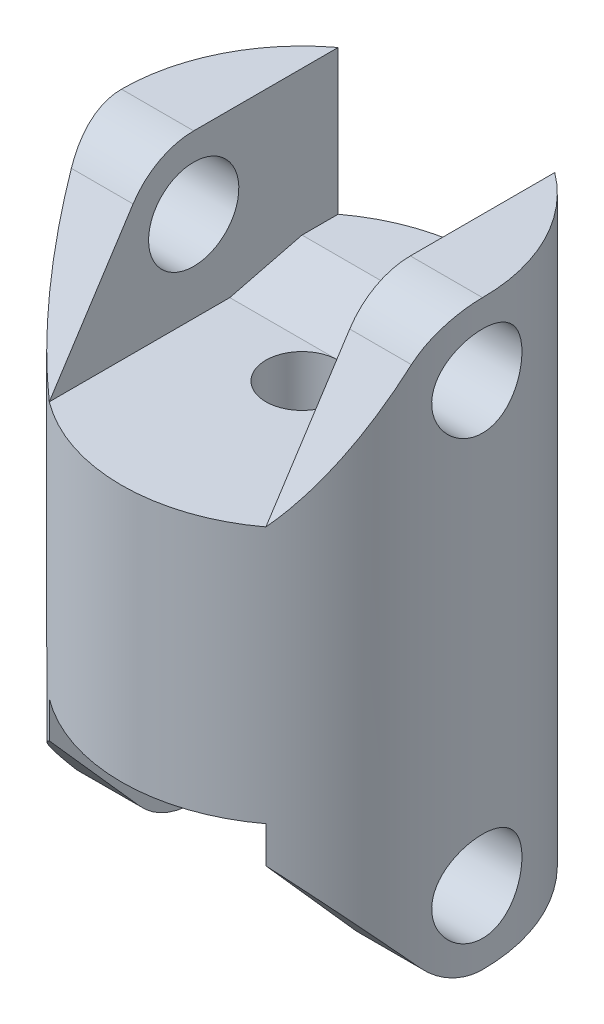
from build123d import *

# Parameters (mm, degrees)
SKETCH1_R               = 12.7
BOSS_EXTRUDE1_DEPTH     = 40.9448
CUT_EXTRUDE1_START      = -11.43
CUT_EXTRUDE1_DEPTH      = 11.43
CUT_EXTRUDE2_DEPTH      = 11.43
CUT_EXTRUDE3_DEPTH      = 48.441216753
CUT_EXTRUDE3_DEPTH_BACK = 48.441216753
SKETCH4_R               = 3.175
SKETCH5_R               = 2.54
CUT_EXTRUDE4_DEPTH      = 35.550013459
BOSS_EXTRUDE2_REACH     = 49.441
BOSS_EXTRUDE3_DEPTH     = 1.27


with BuildPart() as part:
    # Sketch1 → Boss-Extrude1 (new body)
    with BuildSketch(Plane(origin=(0, 0, 0), x_dir=(1, 0, 0), z_dir=(0, 1, 0))):
        with Locations(Location((0, 0, 0), (0, 0, 270))):
            Circle(SKETCH1_R)
    extrude(amount=BOSS_EXTRUDE1_DEPTH)

    # Sketch2 → Cut-Extrude1 (cut)
    with BuildSketch(Plane(origin=(0, 40.9448, 0), x_dir=(1, 0, 0), z_dir=(0, 1, 0)).offset(CUT_EXTRUDE1_START)):
        with BuildLine():
            Line((7.62, 10.16), (7.62, -10.16))
            ThreePointArc((7.62, -10.16), (0, -12.7), (-7.62, -10.16))
            Line((-7.62, -10.16), (-7.62, 10.16))
            ThreePointArc((-7.62, 10.16), (0, 12.7), (7.62, 10.16))
        make_face()
    extrude(amount=CUT_EXTRUDE1_DEPTH, mode=Mode.SUBTRACT)

    # Sketch3 → Cut-Extrude2 (cut)
    with BuildSketch(Plane.XZ):
        with BuildLine():
            Line((-7.62, 10.16), (-7.62, -10.16))
            ThreePointArc((-7.62, -10.16), (0, -12.7), (7.62, -10.16))
            Line((7.62, -10.16), (7.62, 10.16))
            ThreePointArc((7.62, 10.16), (0, 12.7), (-7.62, 10.16))
        make_face()
    extrude(amount=-CUT_EXTRUDE2_DEPTH, mode=Mode.SUBTRACT)

    # Sketch4 → Cut-Extrude3 (cut, two sides: drawn at the far end of the back side and taken through both)
    with BuildSketch(Plane(origin=(-7.62, 0, 0), x_dir=(0, 0, -1), z_dir=(1, 0, 0)).offset(-CUT_EXTRUDE3_DEPTH_BACK)):
        with Locations(Location((0, 35.8648, 0), (0, 0, 270))):
            Circle(SKETCH4_R)
        with Locations(Location((0, 5.08, 0), (0, 0, 270))):
            Circle(SKETCH4_R)
        with BuildLine():
            Line((0, 40.9448), (-10.16, 40.9448))
            Line((-10.16, 40.9448), (-10.16, 29.5148))
            Line((-10.16, 29.5148), (-4.264917923, 38.624668677))
            ThreePointArc((-4.264917923, 38.624668677), (-2.427577715, 40.327228312), (0, 40.9448))
        make_face()
        with BuildLine():
            Line((0, 0), (-12.443407893, 0))
            Line((-12.443407893, 0), (-12.443407893, 11.43))
            Line((-12.443407893, 11.43), (-3.796422114, 1.704562379))
            ThreePointArc((-3.796422114, 1.704562379), (-2.080766311, 0.445691901), (0, 0))
        make_face()
    extrude(amount=CUT_EXTRUDE3_DEPTH + CUT_EXTRUDE3_DEPTH_BACK, mode=Mode.SUBTRACT)

    # Sketch5 → Cut-Extrude4 (cut, through all)
    with BuildSketch(Plane(origin=(0, 29.5148, 0), x_dir=(1, 0, 0), z_dir=(0, 1, 0))):
        with Locations(Location((0, 0, 0), (0, 0, 270))):
            Circle(SKETCH5_R)
    extrude(amount=-CUT_EXTRUDE4_DEPTH, mode=Mode.SUBTRACT)

    # Boss-Extrude2: up to this face of the body (flat: up to its plane)
    boss_extrude2_end = Plane(part.part.faces().sort_by_distance((7.62, 29.747941009, 0))[0])
    # Sketch6 → Boss-Extrude2 (add, up to the picked face)
    with BuildSketch(Plane(origin=(-7.62, 0, 0), x_dir=(0, 0, -1), z_dir=(1, 0, 0)), mode=Mode.PRIVATE) as boss_extrude2_sk1:
        Polygon((2.54, 29.5148), (10.16, 29.5148), (10.16, 30.7848), (7.62, 30.7848), align=None)
    boss_extrude2_tool1 = split(extrude(boss_extrude2_sk1.sketch, amount=BOSS_EXTRUDE2_REACH, mode=Mode.PRIVATE), bisect_by=boss_extrude2_end, keep=Keep.BOTH, mode=Mode.PRIVATE)
    add(boss_extrude2_tool1.solids().sort_by(Axis((-7.62, 30.043967, -7.408333), (1, 0, 0)))[0])

    # Sketch7 → Boss-Extrude3 (add)
    with BuildSketch(Plane(origin=(0, 29.5148, 0), x_dir=(1, 0, 0), z_dir=(0, 1, 0))):
        with BuildLine():
            Line((-7.62, 10.16), (7.62, 10.16))
            ThreePointArc((7.62, 10.16), (0, 12.7), (-7.62, 10.16))
        make_face()
    extrude(amount=BOSS_EXTRUDE3_DEPTH)


solid = part.part
